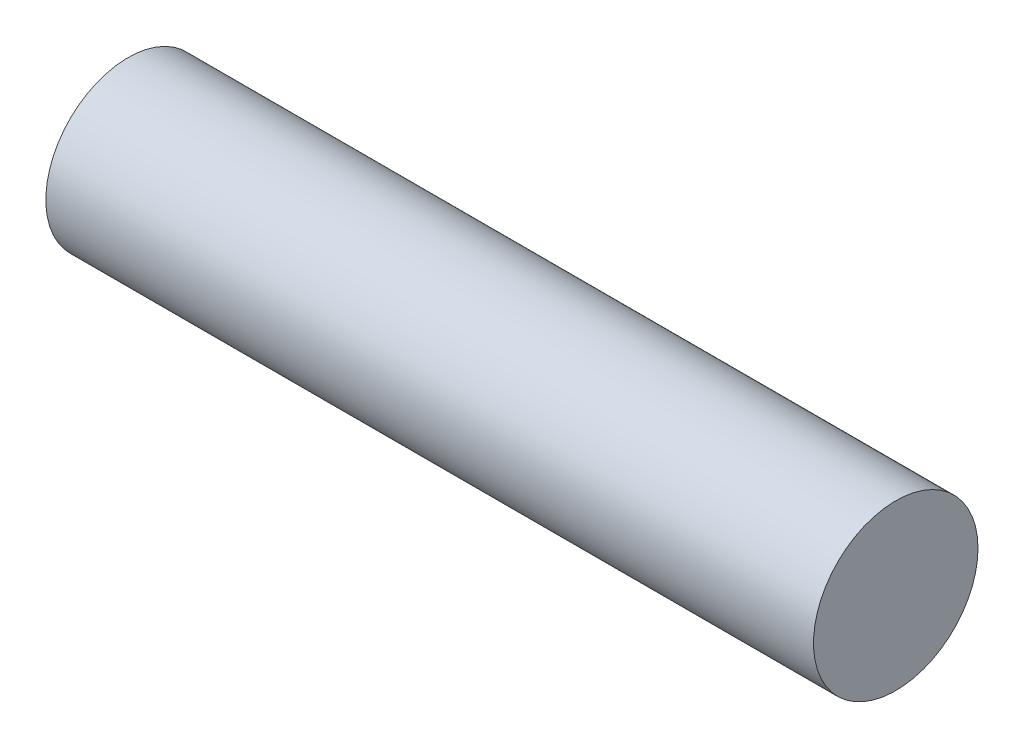
from build123d import *

# Parameters (mm, degrees)
ESBO_O1_R                = 1.5
RESSALTO_EXTRUS_O1_DEPTH = 14


with BuildPart() as part:
    # Esboço1 → Ressalto-extrusão1 (new body)
    with BuildSketch(Plane(origin=(0, 0, 0), x_dir=(0, 0, -1), z_dir=(1, 0, 0))):
        Circle(ESBO_O1_R)
    extrude(amount=RESSALTO_EXTRUS_O1_DEPTH)


solid = part.part
